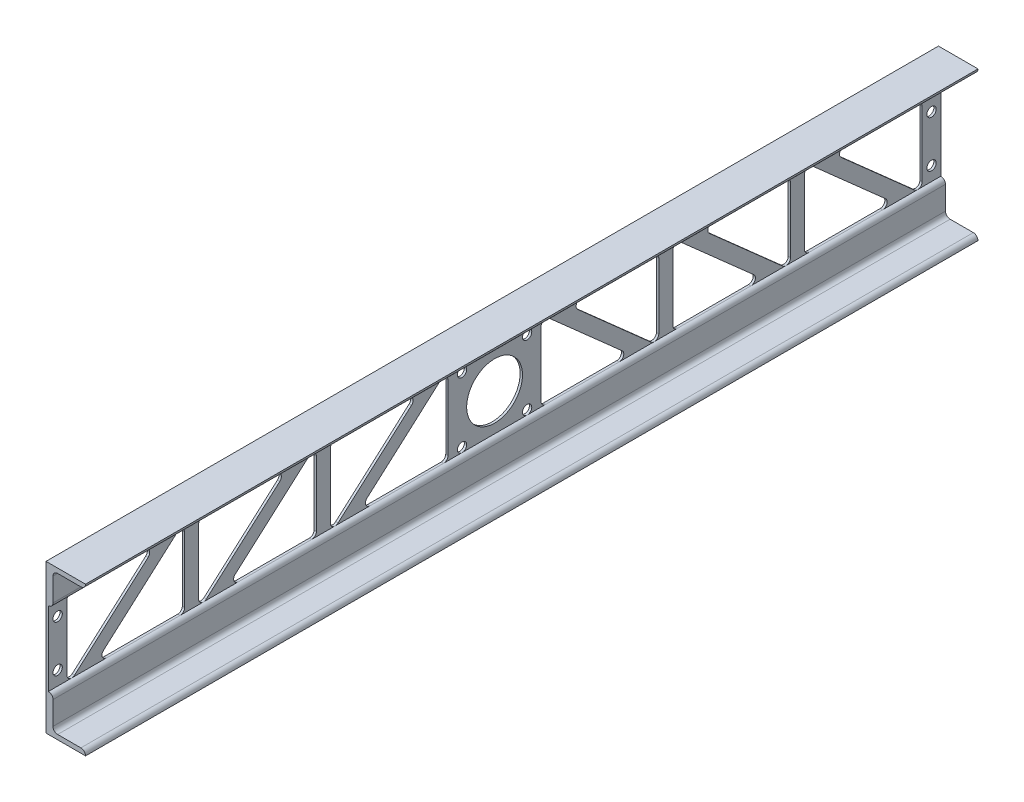
from build123d import *

# Parameters (mm, degrees)
SKETCH1_W           = 1.6002
SKETCH1_H           = 101.6
BOSS_EXTRUDE1_DEPTH = 304.8
BOSS_EXTRUDE2_DEPTH = 304.8
SKETCH3_R           = 19.05
CUT_EXTRUDE1_DEPTH  = 323.289869527
SKETCH4_R           = 3.175
CUT_EXTRUDE2_DEPTH  = 323.289869527
SKETCH5_R           = 3.175
CUT_EXTRUDE3_DEPTH  = 323.289869527


with BuildPart() as part:
    # Sketch1 → Boss-Extrude1 (new, symmetric)
    with BuildSketch(Plane.XY):
        with Locations((0.8001, 50.8)):
            Rectangle(SKETCH1_W, SKETCH1_H)
    extrude(amount=BOSS_EXTRUDE1_DEPTH, both=True)

    # Sketch2 → Boss-Extrude2 (add, symmetric)
    with BuildSketch(Plane.XY):
        with BuildLine():
            Line((27.0002, 101.6), (1.6002, 101.6))
            Line((1.6002, 101.6), (1.6002, 76.2))
            ThreePointArc((1.6002, 76.2), (3.84526403, 77.12993597), (4.7752, 79.375))
            Line((4.7752, 79.375), (4.7752, 95.25))
            ThreePointArc((4.7752, 95.25), (5.70513597, 97.49506403), (7.9502, 98.425))
            Line((7.9502, 98.425), (23.8252, 98.425))
            ThreePointArc((23.8252, 98.425), (26.07026403, 99.35493597), (27.0002, 101.6))
        make_face()
        with BuildLine():
            Line((7.9502, 3.175), (23.8252, 3.175))
            ThreePointArc((23.8252, 3.175), (26.07026403, 2.24506403), (27.0002, 0))
            Line((27.0002, 0), (1.6002, 0))
            Line((1.6002, 0), (1.6002, 25.4))
            ThreePointArc((1.6002, 25.4), (3.84526403, 24.47006403), (4.7752, 22.225))
            Line((4.7752, 22.225), (4.7752, 6.35))
            ThreePointArc((4.7752, 6.35), (5.70513597, 4.10493597), (7.9502, 3.175))
        make_face()
    extrude(amount=BOSS_EXTRUDE2_DEPTH, both=True)

    # Sketch3 → Cut-Extrude1 (cut, through all)
    with BuildSketch(Plane(origin=(1.6002, 0, 0), x_dir=(0, 0, -1), z_dir=(1, 0, 0))):
        with Locations((0, 50.8)):
            Circle(SKETCH3_R)
        with BuildLine():
            Line((-292.1, 73.025), (-292.1, 28.575))
            ThreePointArc((-292.1, 28.575), (-290.227720313, 25.679564837), (-286.819026907, 26.198973416))
            Line((-286.819026907, 26.198973416), (-236.669107137, 70.648973416))
            ThreePointArc((-236.669107137, 70.648973416), (-235.806536024, 74.151219471), (-238.77508023, 76.2))
            Line((-238.77508023, 76.2), (-288.925, 76.2))
            ThreePointArc((-288.925, 76.2), (-291.17006403, 75.27006403), (-292.1, 73.025))
        make_face()
        with BuildLine():
            Line((-264.991586436, 25.4), (-214.841666667, 25.4))
            ThreePointArc((-214.841666667, 25.4), (-212.596602636, 26.32993597), (-211.666666667, 28.575))
            Line((-211.666666667, 28.575), (-211.666666667, 73.025))
            ThreePointArc((-211.666666667, 73.025), (-213.538946354, 75.920435163), (-216.94763976, 75.401026584))
            Line((-216.94763976, 75.401026584), (-267.09755953, 30.951026584))
            ThreePointArc((-267.09755953, 30.951026584), (-267.960130642, 27.448780529), (-264.991586436, 25.4))
        make_face()
        with BuildLine():
            Line((-202.141666667, 73.025), (-202.141666667, 28.575))
            ThreePointArc((-202.141666667, 28.575), (-200.26938698, 25.679564837), (-196.860693573, 26.198973416))
            Line((-196.860693573, 26.198973416), (-146.710773804, 70.648973416))
            ThreePointArc((-146.710773804, 70.648973416), (-145.848202691, 74.151219471), (-148.816746897, 76.2))
            Line((-148.816746897, 76.2), (-198.966666667, 76.2))
            ThreePointArc((-198.966666667, 76.2), (-201.211730697, 75.27006403), (-202.141666667, 73.025))
        make_face()
        with BuildLine():
            Line((-126.989306427, 75.401026584), (-177.139226196, 30.951026584))
            ThreePointArc((-177.139226196, 30.951026584), (-178.001797309, 27.448780529), (-175.033253103, 25.4))
            Line((-175.033253103, 25.4), (-124.883333333, 25.4))
            ThreePointArc((-124.883333333, 25.4), (-122.638269303, 26.32993597), (-121.708333333, 28.575))
            Line((-121.708333333, 28.575), (-121.708333333, 73.025))
            ThreePointArc((-121.708333333, 73.025), (-123.58061302, 75.920435163), (-126.989306427, 75.401026584))
        make_face()
        with BuildLine():
            Line((-112.183333333, 73.025), (-112.183333333, 28.575))
            ThreePointArc((-112.183333333, 28.575), (-110.311053646, 25.679564837), (-106.90236024, 26.198973416))
            Line((-106.90236024, 26.198973416), (-56.75244047, 70.648973416))
            ThreePointArc((-56.75244047, 70.648973416), (-55.889869358, 74.151219471), (-58.858413564, 76.2))
            Line((-58.858413564, 76.2), (-109.008333333, 76.2))
            ThreePointArc((-109.008333333, 76.2), (-111.253397364, 75.27006403), (-112.183333333, 73.025))
        make_face()
        with BuildLine():
            Line((-37.030973093, 75.401026584), (-87.180892863, 30.951026584))
            ThreePointArc((-87.180892863, 30.951026584), (-88.043463976, 27.448780529), (-85.07491977, 25.4))
            Line((-85.07491977, 25.4), (-34.925, 25.4))
            ThreePointArc((-34.925, 25.4), (-32.67993597, 26.32993597), (-31.75, 28.575))
            Line((-31.75, 28.575), (-31.75, 73.025))
            ThreePointArc((-31.75, 73.025), (-33.622279687, 75.920435163), (-37.030973093, 75.401026584))
        make_face()
        with BuildLine():
            Line((85.07491977, 25.4), (34.925, 25.4))
            ThreePointArc((34.925, 25.4), (32.67993597, 26.32993597), (31.75, 28.575))
            Line((31.75, 28.575), (31.75, 73.025))
            ThreePointArc((31.75, 73.025), (33.622279687, 75.920435163), (37.030973093, 75.401026584))
            Line((37.030973093, 75.401026584), (87.180892863, 30.951026584))
            ThreePointArc((87.180892863, 30.951026584), (88.043463976, 27.448780529), (85.07491977, 25.4))
        make_face()
        with BuildLine():
            Line((56.75244047, 70.648973416), (106.90236024, 26.198973416))
            ThreePointArc((106.90236024, 26.198973416), (110.311053646, 25.679564837), (112.183333333, 28.575))
            Line((112.183333333, 28.575), (112.183333333, 73.025))
            ThreePointArc((112.183333333, 73.025), (111.253397364, 75.27006403), (109.008333333, 76.2))
            Line((109.008333333, 76.2), (58.858413564, 76.2))
            ThreePointArc((58.858413564, 76.2), (55.889869358, 74.151219471), (56.75244047, 70.648973416))
        make_face()
        with BuildLine():
            Line((175.033253103, 25.4), (124.883333333, 25.4))
            ThreePointArc((124.883333333, 25.4), (122.638269303, 26.32993597), (121.708333333, 28.575))
            Line((121.708333333, 28.575), (121.708333333, 73.025))
            ThreePointArc((121.708333333, 73.025), (123.58061302, 75.920435163), (126.989306427, 75.401026584))
            Line((126.989306427, 75.401026584), (177.139226196, 30.951026584))
            ThreePointArc((177.139226196, 30.951026584), (178.001797309, 27.448780529), (175.033253103, 25.4))
        make_face()
        with BuildLine():
            Line((146.710773804, 70.648973416), (196.860693573, 26.198973416))
            ThreePointArc((196.860693573, 26.198973416), (200.26938698, 25.679564837), (202.141666667, 28.575))
            Line((202.141666667, 28.575), (202.141666667, 73.025))
            ThreePointArc((202.141666667, 73.025), (201.211730697, 75.27006403), (198.966666667, 76.2))
            Line((198.966666667, 76.2), (148.816746897, 76.2))
            ThreePointArc((148.816746897, 76.2), (145.848202691, 74.151219471), (146.710773804, 70.648973416))
        make_face()
        with BuildLine():
            Line((216.94763976, 75.401026584), (267.09755953, 30.951026584))
            ThreePointArc((267.09755953, 30.951026584), (267.960130642, 27.448780529), (264.991586436, 25.4))
            Line((264.991586436, 25.4), (214.841666667, 25.4))
            ThreePointArc((214.841666667, 25.4), (212.596602636, 26.32993597), (211.666666667, 28.575))
            Line((211.666666667, 28.575), (211.666666667, 73.025))
            ThreePointArc((211.666666667, 73.025), (213.538946354, 75.920435163), (216.94763976, 75.401026584))
        make_face()
        with BuildLine():
            Line((236.669107137, 70.648973416), (286.819026907, 26.198973416))
            ThreePointArc((286.819026907, 26.198973416), (290.227720313, 25.679564837), (292.1, 28.575))
            Line((292.1, 28.575), (292.1, 73.025))
            ThreePointArc((292.1, 73.025), (291.17006403, 75.27006403), (288.925, 76.2))
            Line((288.925, 76.2), (238.77508023, 76.2))
            ThreePointArc((238.77508023, 76.2), (235.806536024, 74.151219471), (236.669107137, 70.648973416))
        make_face()
    extrude(amount=-CUT_EXTRUDE1_DEPTH, mode=Mode.SUBTRACT)

    # Sketch4 → Cut-Extrude2 (cut, through all)
    with BuildSketch(Plane(origin=(1.6002, 0, 0), x_dir=(0, 0, -1), z_dir=(1, 0, 0))):
        with Locations((-22.225, 73.025)):
            Circle(SKETCH4_R)
        with Locations((22.225, 73.025)):
            Circle(SKETCH4_R)
        with Locations((22.225, 28.575)):
            Circle(SKETCH4_R)
        with Locations((-22.225, 28.575)):
            Circle(SKETCH4_R)
    extrude(amount=-CUT_EXTRUDE2_DEPTH, mode=Mode.SUBTRACT)

    # Sketch5 → Cut-Extrude3 (cut, through all)
    with BuildSketch(Plane(origin=(1.6002, 0, 0), x_dir=(0, 0, -1), z_dir=(1, 0, 0))):
        with Locations((-298.45, 66.675)):
            Circle(SKETCH5_R)
        with Locations((-298.45, 34.925)):
            Circle(SKETCH5_R)
        with Locations(Location((298.45, 34.925, 0), (0, 0, 180))):
            Circle(SKETCH5_R)
        with Locations(Location((298.45, 66.675, 0), (0, 0, 180))):
            Circle(SKETCH5_R)
    extrude(amount=-CUT_EXTRUDE3_DEPTH, mode=Mode.SUBTRACT)


solid = part.part
